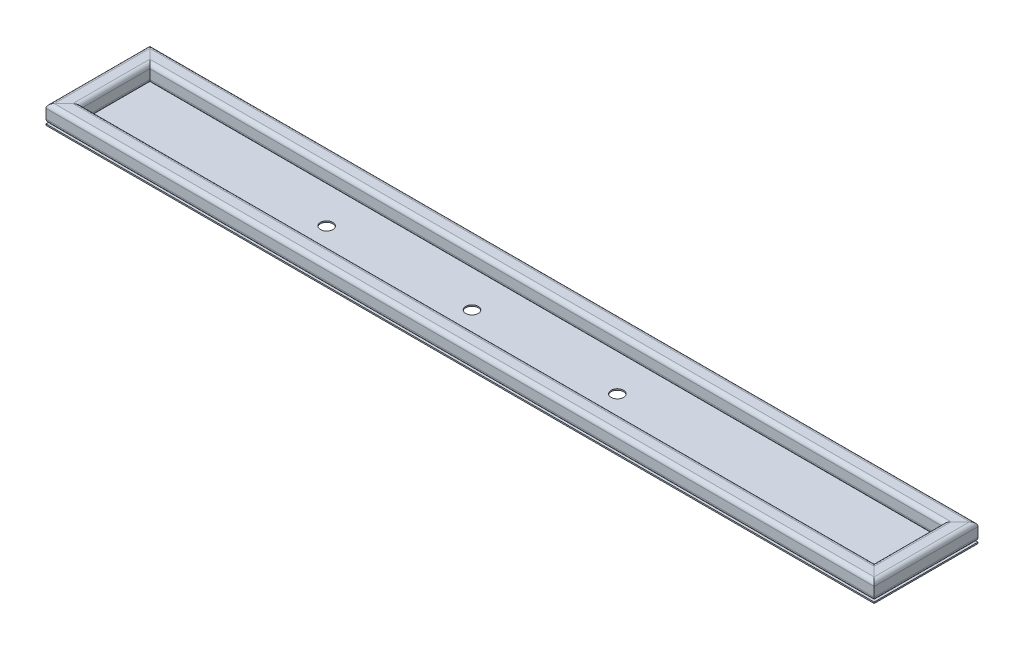
from build123d import *

# Parameters (mm, degrees)
TUBO_CUADRADO_2_X_2_X_0_25_1_DEPTH      = 186.921024484
TUBO_CUADRADO_2_X_2_X_0_25_1_DEPTH_BACK = 36.921024484
TUBO_CUADRADO_2_X_2_X_0_25_1_2_DEPTH    = 1270.242048969
TUBO_CUADRADO_2_X_2_X_0_25_1_3_DEPTH    = 223.842048969
TUBO_CUADRADO_2_X_2_X_0_25_1_4_DEPTH    = 1270.242048969
CROQUIS3_W                              = 1196.4
CROQUIS3_H                              = 150
SALIENTE_EXTRUIR1_DEPTH                 = 1.9
CROQUIS6_R                              = 9
CORTAR_EXTRUIR1_DEPTH                   = 10


with BuildPart() as part:
    # Sketch1 → Tubo cuadrado 2 X 2 X 0.25(1) (new, two sides: drawn at the far end of the back side and taken through both)
    with BuildSketch(Plane(origin=(-585.5, 12.7, -75), x_dir=(1, 0, 0), z_dir=(0, 0, 1)).offset(-TUBO_CUADRADO_2_X_2_X_0_25_1_DEPTH_BACK)):
        with BuildLine():
            Line((-6.7, -12.7), (6.7, -12.7))
            ThreePointArc((6.7, -12.7), (10.942640687, -10.942640687), (12.7, -6.7))
            Line((12.7, -6.7), (12.7, 6.7))
            ThreePointArc((12.7, 6.7), (10.942640687, 10.942640687), (6.7, 12.7))
            Line((6.7, 12.7), (-6.7, 12.7))
            ThreePointArc((-6.7, 12.7), (-10.942640687, 10.942640687), (-12.7, 6.7))
            Line((-12.7, 6.7), (-12.7, -6.7))
            ThreePointArc((-12.7, -6.7), (-10.942640687, -10.942640687), (-6.7, -12.7))
        make_face()
        with BuildLine():
            Line((-6.7, -9.7), (6.7, -9.7))
            ThreePointArc((6.7, -9.7), (8.821320344, -8.821320344), (9.7, -6.7))
            Line((9.7, -6.7), (9.7, 6.7))
            ThreePointArc((9.7, 6.7), (8.821320344, 8.821320344), (6.7, 9.7))
            Line((6.7, 9.7), (-6.7, 9.7))
            ThreePointArc((-6.7, 9.7), (-8.821320344, 8.821320344), (-9.7, 6.7))
            Line((-9.7, 6.7), (-9.7, -6.7))
            ThreePointArc((-9.7, -6.7), (-8.821320344, -8.821320344), (-6.7, -9.7))
        make_face(mode=Mode.SUBTRACT)
    extrude(amount=TUBO_CUADRADO_2_X_2_X_0_25_1_DEPTH + TUBO_CUADRADO_2_X_2_X_0_25_1_DEPTH_BACK)

    # Tubo cuadrado 2 X 2 X 0.25(1) mitre 1
    split(bisect_by=Plane(origin=(-598.2, 0, -75), x_dir=(0, -1, 0), z_dir=(-0.707106781, 0, 0.707106781)), keep=Keep.TOP)

    # Tubo cuadrado 2 X 2 X 0.25(1) mitre 2
    split(bisect_by=Plane(origin=(-598.2, 0, 75), x_dir=(0, -1, 0), z_dir=(-0.707106781, 0, -0.707106781)), keep=Keep.TOP)


with BuildPart() as body_2:
    # Sketch1 on segment 2 (carried to segment 2) → Tubo cuadrado 2 X 2 X 0.25_1 2 (new body)
    with BuildSketch(Plane(origin=(-635.121024484, 12.7, 62.3), x_dir=(0, 0, -1), z_dir=(1, 0, 0))):
        with BuildLine():
            Line((-6.7, -12.7), (6.7, -12.7))
            ThreePointArc((6.7, -12.7), (10.942640687, -10.942640687), (12.7, -6.7))
            Line((12.7, -6.7), (12.7, 6.7))
            ThreePointArc((12.7, 6.7), (10.942640687, 10.942640687), (6.7, 12.7))
            Line((6.7, 12.7), (-6.7, 12.7))
            ThreePointArc((-6.7, 12.7), (-10.942640687, 10.942640687), (-12.7, 6.7))
            Line((-12.7, 6.7), (-12.7, -6.7))
            ThreePointArc((-12.7, -6.7), (-10.942640687, -10.942640687), (-6.7, -12.7))
        make_face()
        with BuildLine():
            Line((-6.7, -9.7), (6.7, -9.7))
            ThreePointArc((6.7, -9.7), (8.821320344, -8.821320344), (9.7, -6.7))
            Line((9.7, -6.7), (9.7, 6.7))
            ThreePointArc((9.7, 6.7), (8.821320344, 8.821320344), (6.7, 9.7))
            Line((6.7, 9.7), (-6.7, 9.7))
            ThreePointArc((-6.7, 9.7), (-8.821320344, 8.821320344), (-9.7, 6.7))
            Line((-9.7, 6.7), (-9.7, -6.7))
            ThreePointArc((-9.7, -6.7), (-8.821320344, -8.821320344), (-6.7, -9.7))
        make_face(mode=Mode.SUBTRACT)
    extrude(amount=TUBO_CUADRADO_2_X_2_X_0_25_1_2_DEPTH)

    # Tubo cuadrado 2 X 2 X 0.25_1 2 mitre 1
    split(bisect_by=Plane(origin=(-598.2, 0, 75), x_dir=(0, 1, 0), z_dir=(0.707106781, 0, 0.707106781)), keep=Keep.TOP)

    # Tubo cuadrado 2 X 2 X 0.25_1 2 mitre 2
    split(bisect_by=Plane(origin=(598.2, 0, 75), x_dir=(0, -1, 0), z_dir=(-0.707106781, 0, 0.707106781)), keep=Keep.TOP)


with BuildPart() as body_3:
    # Sketch1 on segment 3 (carried to segment 3) → Tubo cuadrado 2 X 2 X 0.25_1 3 (new body)
    with BuildSketch(Plane(origin=(585.5, 12.7, 111.921024484), x_dir=(-1, 0, 0), z_dir=(0, 0, -1))):
        with BuildLine():
            Line((-6.7, -12.7), (6.7, -12.7))
            ThreePointArc((6.7, -12.7), (10.942640687, -10.942640687), (12.7, -6.7))
            Line((12.7, -6.7), (12.7, 6.7))
            ThreePointArc((12.7, 6.7), (10.942640687, 10.942640687), (6.7, 12.7))
            Line((6.7, 12.7), (-6.7, 12.7))
            ThreePointArc((-6.7, 12.7), (-10.942640687, 10.942640687), (-12.7, 6.7))
            Line((-12.7, 6.7), (-12.7, -6.7))
            ThreePointArc((-12.7, -6.7), (-10.942640687, -10.942640687), (-6.7, -12.7))
        make_face()
        with BuildLine():
            Line((-6.7, -9.7), (6.7, -9.7))
            ThreePointArc((6.7, -9.7), (8.821320344, -8.821320344), (9.7, -6.7))
            Line((9.7, -6.7), (9.7, 6.7))
            ThreePointArc((9.7, 6.7), (8.821320344, 8.821320344), (6.7, 9.7))
            Line((6.7, 9.7), (-6.7, 9.7))
            ThreePointArc((-6.7, 9.7), (-8.821320344, 8.821320344), (-9.7, 6.7))
            Line((-9.7, 6.7), (-9.7, -6.7))
            ThreePointArc((-9.7, -6.7), (-8.821320344, -8.821320344), (-6.7, -9.7))
        make_face(mode=Mode.SUBTRACT)
    extrude(amount=TUBO_CUADRADO_2_X_2_X_0_25_1_3_DEPTH)

    # Tubo cuadrado 2 X 2 X 0.25_1 3 mitre 1
    split(bisect_by=Plane(origin=(598.2, 0, -75), x_dir=(0, 1, 0), z_dir=(0.707106781, 0, 0.707106781)), keep=Keep.TOP)

    # Tubo cuadrado 2 X 2 X 0.25_1 3 mitre 2
    split(bisect_by=Plane(origin=(598.2, 0, 75), x_dir=(0, 1, 0), z_dir=(0.707106781, 0, -0.707106781)), keep=Keep.TOP)


with BuildPart() as body_4:
    # Sketch1 on segment 4 (carried to segment 4) → Tubo cuadrado 2 X 2 X 0.25_1 4 (new body)
    with BuildSketch(Plane(origin=(635.121024484, 12.7, -62.3), x_dir=(0, 0, 1), z_dir=(-1, 0, 0))):
        with BuildLine():
            Line((-6.7, -12.7), (6.7, -12.7))
            ThreePointArc((6.7, -12.7), (10.942640687, -10.942640687), (12.7, -6.7))
            Line((12.7, -6.7), (12.7, 6.7))
            ThreePointArc((12.7, 6.7), (10.942640687, 10.942640687), (6.7, 12.7))
            Line((6.7, 12.7), (-6.7, 12.7))
            ThreePointArc((-6.7, 12.7), (-10.942640687, 10.942640687), (-12.7, 6.7))
            Line((-12.7, 6.7), (-12.7, -6.7))
            ThreePointArc((-12.7, -6.7), (-10.942640687, -10.942640687), (-6.7, -12.7))
        make_face()
        with BuildLine():
            Line((-6.7, -9.7), (6.7, -9.7))
            ThreePointArc((6.7, -9.7), (8.821320344, -8.821320344), (9.7, -6.7))
            Line((9.7, -6.7), (9.7, 6.7))
            ThreePointArc((9.7, 6.7), (8.821320344, 8.821320344), (6.7, 9.7))
            Line((6.7, 9.7), (-6.7, 9.7))
            ThreePointArc((-6.7, 9.7), (-8.821320344, 8.821320344), (-9.7, 6.7))
            Line((-9.7, 6.7), (-9.7, -6.7))
            ThreePointArc((-9.7, -6.7), (-8.821320344, -8.821320344), (-6.7, -9.7))
        make_face(mode=Mode.SUBTRACT)
    extrude(amount=TUBO_CUADRADO_2_X_2_X_0_25_1_4_DEPTH)

    # Tubo cuadrado 2 X 2 X 0.25_1 4 mitre 1
    split(bisect_by=Plane(origin=(-598.2, 0, -75), x_dir=(0, 1, 0), z_dir=(0.707106781, 0, -0.707106781)), keep=Keep.TOP)

    # Tubo cuadrado 2 X 2 X 0.25_1 4 mitre 2
    split(bisect_by=Plane(origin=(598.2, 0, -75), x_dir=(0, -1, 0), z_dir=(-0.707106781, 0, -0.707106781)), keep=Keep.TOP)


with BuildPart() as body_5:
    # Croquis3 → Saliente-Extruir1 (new body)
    with BuildSketch(Plane.XZ):
        Rectangle(CROQUIS3_W, CROQUIS3_H)
    extrude(amount=SALIENTE_EXTRUIR1_DEPTH)

    # Croquis6 → Cortar-Extruir1 (cut)
    with BuildSketch(Plane.XZ.offset(1.9)):
        with Locations((-267.8, 0)):
            Circle(CROQUIS6_R)
        with Locations((-57.8, 0)):
            Circle(CROQUIS6_R)
        with Locations((152.2, 0)):
            Circle(CROQUIS6_R)
    extrude(amount=-CORTAR_EXTRUIR1_DEPTH, mode=Mode.SUBTRACT)


solid = Compound([part.part, body_2.part, body_3.part, body_4.part, body_5.part])
